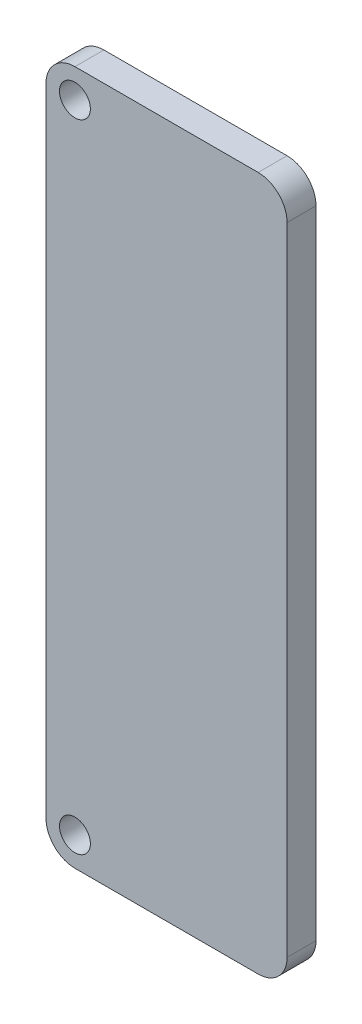
from build123d import *

# Parameters (mm, degrees)
SKETCH1_R           = 1.6
BOSS_EXTRUDE1_DEPTH = 3
FILLET1_R           = 3


with BuildPart() as part:
    # Sketch1 → Boss-Extrude1 (new body)
    with BuildSketch(Plane.XY):
        with BuildLine():
            Line((0, 36), (0, -36))
            Line((0, -36), (-22, -36))
            ThreePointArc((-22, -36), (-24.121320344, -35.121320344), (-25, -33))
            Line((-25, -33), (-25, 33))
            ThreePointArc((-25, 33), (-24.121320344, 35.121320344), (-22, 36))
            Line((-22, 36), (0, 36))
        make_face()
        with Locations((-22, 33)):
            Circle(SKETCH1_R, mode=Mode.SUBTRACT)
        with Locations((-22, -33)):
            Circle(SKETCH1_R, mode=Mode.SUBTRACT)
    extrude(amount=BOSS_EXTRUDE1_DEPTH)

    # Fillet1
    fillet1_edges = [part.edges().sort_by_distance(p)[0] for p in [
        (0, 36, 1.5),
        (0, -36, 1.5),
    ]]
    fillet(fillet1_edges, radius=FILLET1_R)


solid = part.part
